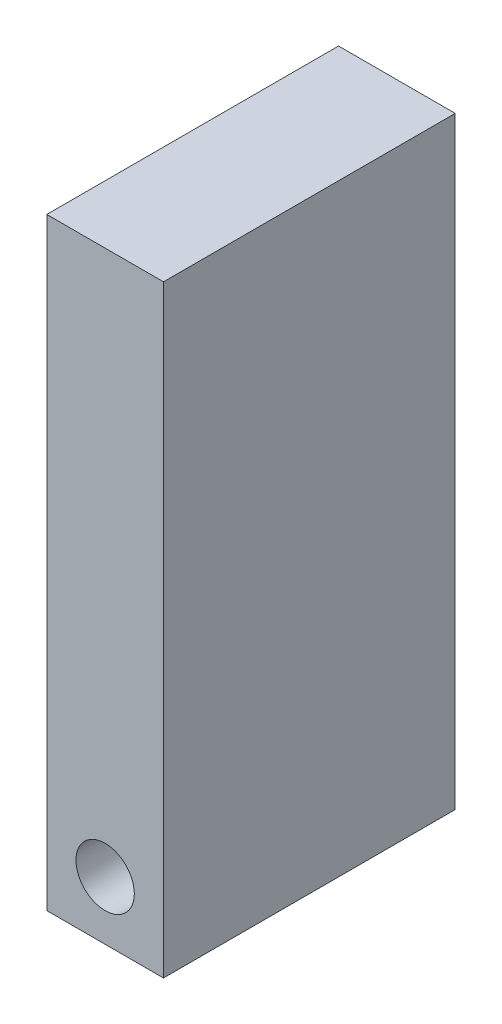
from build123d import *

# Parameters (mm, degrees)
SKETCH_1_W          = 6
SKETCH_1_H          = 28
SKETCH_1_R          = 1.5
EXTRUDE_1_DEPTH     = 20
SKETCH_2_W          = 6
SKETCH_2_H          = 20
EXTRUDE_2_DEPTH     = 3
SKETCH_3_W          = 5
SKETCH_3_H          = 31
CUT_EXTRUDE_1_DEPTH = 8


with BuildPart() as part:
    # 草图1 → 凸台-拉伸1 (new body)
    with BuildSketch(Plane.XY):
        with Locations((3, -14)):
            Rectangle(SKETCH_1_W, SKETCH_1_H)
        with Locations((3, -25)):
            Circle(SKETCH_1_R, mode=Mode.SUBTRACT)
    extrude(amount=EXTRUDE_1_DEPTH)

    # 草图2 → 凸台-拉伸2 (add)
    with BuildSketch(Plane(origin=(0, 0, 0), x_dir=(1, 0, 0), z_dir=(0, 1, 0))):
        with Locations((3, -10)):
            Rectangle(SKETCH_2_W, SKETCH_2_H)
    extrude(amount=EXTRUDE_2_DEPTH)

    # 草图3 → 切除-拉伸1 (cut)
    with BuildSketch(Plane(origin=(6, 0, 0), x_dir=(0, 0, -1), z_dir=(1, 0, 0))):
        with Locations((-2.5, -12.5)):
            Rectangle(SKETCH_3_W, SKETCH_3_H)
    extrude(amount=-CUT_EXTRUDE_1_DEPTH, mode=Mode.SUBTRACT)


solid = part.part
